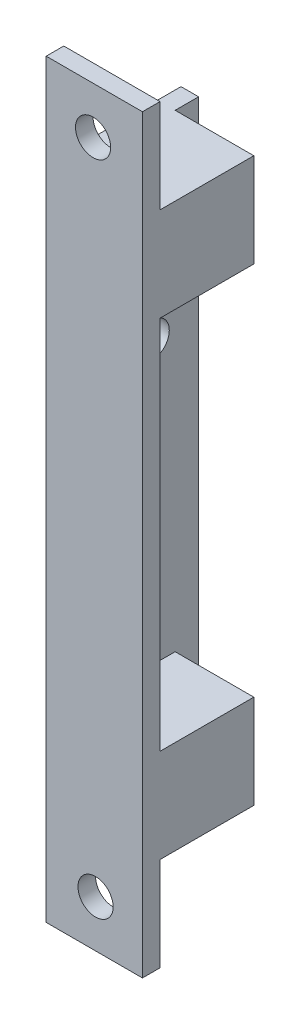
from build123d import *

# Parameters (mm, degrees)
SKETCH2_W           = 31.75
SKETCH2_H           = 152.4
SKETCH2_R           = 4.7625
BOSS_EXTRUDE1_DEPTH = 4.7625
SKETCH3_W           = 26.07038402
SKETCH3_H           = 203.2
SKETCH3_R           = 4.7625
BOSS_EXTRUDE2_DEPTH = 4.7625
SKETCH4_W           = 21.30788402
SKETCH4_H           = 25.4
BOSS_EXTRUDE3_DEPTH = 25.4


with BuildPart() as part:
    # Sketch2 → Boss-Extrude1 (new body)
    with BuildSketch(Plane(origin=(0, 0, 0), x_dir=(0, 0, -1), z_dir=(1, 0, 0))):
        with Locations((15.875, 76.2)):
            Rectangle(SKETCH2_W, SKETCH2_H)
        with Locations((19.05, 101.6)):
            Circle(SKETCH2_R, mode=Mode.SUBTRACT)
    extrude(amount=-BOSS_EXTRUDE1_DEPTH)

    # Sketch3 → Boss-Extrude2 (add)
    with BuildSketch(Plane.XY):
        with Locations((8.27269201, 76.2)):
            Rectangle(SKETCH3_W, SKETCH3_H)
        with Locations(Location((7.9375, 165.1, 0), (0, 0, 180))):
            Circle(SKETCH3_R, mode=Mode.SUBTRACT)
        with Locations(Location((8.60788402, -12.7, 0), (0, 0, 180))):
            Circle(SKETCH3_R, mode=Mode.SUBTRACT)
    extrude(amount=BOSS_EXTRUDE2_DEPTH)

    # Sketch4 → Boss-Extrude3 (add)
    with BuildSketch(Plane(origin=(0, 0, 0), x_dir=(-1, 0, 0), z_dir=(0, 0, -1))):
        with Locations((-10.65394201, 139.7)):
            Rectangle(SKETCH4_W, SKETCH4_H)
        with Locations((-10.65394201, 12.7)):
            Rectangle(SKETCH4_W, SKETCH4_H)
    extrude(amount=BOSS_EXTRUDE3_DEPTH)


solid = part.part
